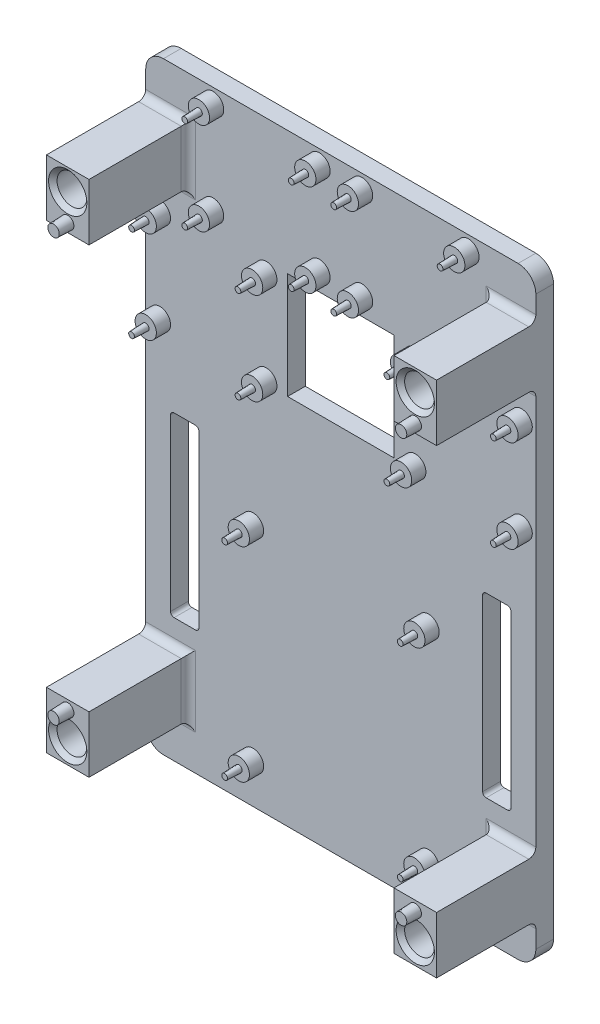
from build123d import *

# Parameters (mm, degrees)
SKIZZE1_W                                  = 110
SKIZZE1_H                                  = 170
AUFSATZ_LINEAR_AUSTRAGEN1_DEPTH            = 5
VERRUNDUNG1_R                              = 5
SKIZZE7_W                                  = 12
SKIZZE7_H                                  = 16
AUFSATZ_LINEAR_AUSTRAGEN3_DEPTH            = 28
VERRUNDUNG2_R                              = 2
SKIZZE8_R                                  = 4.2
SCHNITT_LINEAR_AUSTRAGEN3_DEPTH            = 107.484740691
LINEARES_MUSTER1_COUNT                     = 2
LINEARES_MUSTER1_PITCH                     = 134
LINEARES_MUSTER1_COUNT_DIR2                = 2
LINEARES_MUSTER1_PITCH_DIR2                = 98
SKIZZE9_R                                  = 3
AUFSATZ_LINEAR_AUSTRAGEN4_DEPTH            = 4
SKIZZE10_R                                 = 0.95
AUFSATZ_LINEAR_AUSTRAGEN5_DEPTH            = 4
AUFSATZ_LINEAR_AUSTRAGEN5_DRAFT            = 2
AUFSATZ_LINEAR_AUSTRAGEN5_PROFILE_2_DEPTH  = 4
AUFSATZ_LINEAR_AUSTRAGEN5_PROFILE_2_DRAFT  = 2
AUFSATZ_LINEAR_AUSTRAGEN5_PROFILE_3_DEPTH  = 4
AUFSATZ_LINEAR_AUSTRAGEN5_PROFILE_3_DRAFT  = 2
AUFSATZ_LINEAR_AUSTRAGEN5_PROFILE_4_DEPTH  = 4
AUFSATZ_LINEAR_AUSTRAGEN5_PROFILE_4_DRAFT  = 2
AUFSATZ_LINEAR_AUSTRAGEN5_PROFILE_5_DEPTH  = 4
AUFSATZ_LINEAR_AUSTRAGEN5_PROFILE_5_DRAFT  = 2
AUFSATZ_LINEAR_AUSTRAGEN5_PROFILE_6_DEPTH  = 4
AUFSATZ_LINEAR_AUSTRAGEN5_PROFILE_6_DRAFT  = 2
AUFSATZ_LINEAR_AUSTRAGEN5_PROFILE_7_DEPTH  = 4
AUFSATZ_LINEAR_AUSTRAGEN5_PROFILE_7_DRAFT  = 2
AUFSATZ_LINEAR_AUSTRAGEN5_PROFILE_8_DEPTH  = 4
AUFSATZ_LINEAR_AUSTRAGEN5_PROFILE_8_DRAFT  = 2
AUFSATZ_LINEAR_AUSTRAGEN5_PROFILE_9_DEPTH  = 4
AUFSATZ_LINEAR_AUSTRAGEN5_PROFILE_9_DRAFT  = 2
AUFSATZ_LINEAR_AUSTRAGEN5_PROFILE_10_DEPTH = 4
AUFSATZ_LINEAR_AUSTRAGEN5_PROFILE_10_DRAFT = 2
AUFSATZ_LINEAR_AUSTRAGEN5_PROFILE_11_DEPTH = 4
AUFSATZ_LINEAR_AUSTRAGEN5_PROFILE_11_DRAFT = 2
AUFSATZ_LINEAR_AUSTRAGEN5_PROFILE_12_DEPTH = 4
AUFSATZ_LINEAR_AUSTRAGEN5_PROFILE_12_DRAFT = 2
AUFSATZ_LINEAR_AUSTRAGEN5_PROFILE_13_DEPTH = 4
AUFSATZ_LINEAR_AUSTRAGEN5_PROFILE_13_DRAFT = 2
AUFSATZ_LINEAR_AUSTRAGEN5_PROFILE_14_DEPTH = 4
AUFSATZ_LINEAR_AUSTRAGEN5_PROFILE_14_DRAFT = 2
AUFSATZ_LINEAR_AUSTRAGEN5_PROFILE_15_DEPTH = 4
AUFSATZ_LINEAR_AUSTRAGEN5_PROFILE_15_DRAFT = 2
AUFSATZ_LINEAR_AUSTRAGEN5_PROFILE_16_DEPTH = 4
AUFSATZ_LINEAR_AUSTRAGEN5_PROFILE_16_DRAFT = 2
AUFSATZ_LINEAR_AUSTRAGEN5_PROFILE_17_DEPTH = 4
AUFSATZ_LINEAR_AUSTRAGEN5_PROFILE_17_DRAFT = 2
AUFSATZ_LINEAR_AUSTRAGEN5_PROFILE_18_DEPTH = 4
AUFSATZ_LINEAR_AUSTRAGEN5_PROFILE_18_DRAFT = 2
AUFSATZ_LINEAR_AUSTRAGEN5_PROFILE_19_DEPTH = 4
AUFSATZ_LINEAR_AUSTRAGEN5_PROFILE_19_DRAFT = 2
AUFSATZ_LINEAR_AUSTRAGEN5_PROFILE_20_DEPTH = 4
AUFSATZ_LINEAR_AUSTRAGEN5_PROFILE_20_DRAFT = 2
FASE1_SIZE                                 = 1.2
SKIZZE11_W                                 = 30
SKIZZE11_H                                 = 30
SCHNITT_LINEAR_AUSTRAGEN4_DEPTH            = 106.0428484
SKIZZE12_R                                 = 1.75
AUFSATZ_LINEAR_AUSTRAGEN6_DEPTH            = 4
AUFSATZ_LINEAR_AUSTRAGEN6_DRAFT            = 2
AUFSATZ_LINEAR_AUSTRAGEN6_PROFILE_2_DEPTH  = 4
AUFSATZ_LINEAR_AUSTRAGEN6_PROFILE_2_DRAFT  = 2
AUFSATZ_LINEAR_AUSTRAGEN6_PROFILE_3_DEPTH  = 4
AUFSATZ_LINEAR_AUSTRAGEN6_PROFILE_3_DRAFT  = 2
AUFSATZ_LINEAR_AUSTRAGEN6_PROFILE_4_DEPTH  = 4
AUFSATZ_LINEAR_AUSTRAGEN6_PROFILE_4_DRAFT  = 2
SKIZZE13_R                                 = 2
SCHNITT_LINEAR_AUSTRAGEN5_DEPTH            = 4.5
SKIZZE15_W                                 = 8
SKIZZE15_H                                 = 50
SCHNITT_LINEAR_AUSTRAGEN6_DEPTH            = 107.179093987
VERRUNDUNG3_R                              = 1


with BuildPart() as part:
    # Skizze1 → Aufsatz-Linear austragen1 (new body)
    with BuildSketch(Plane.XY):
        Rectangle(SKIZZE1_W, SKIZZE1_H)
    extrude(amount=AUFSATZ_LINEAR_AUSTRAGEN1_DEPTH)

    # Verrundung1
    verrundung1_edges = [part.edges().sort_by_distance(p)[0] for p in [
        (55, -85, 2.5),
        (-55, -85, 2.5),
        (-55, 85, 2.5),
        (55, 85, 2.5),
    ]]
    fillet(verrundung1_edges, radius=VERRUNDUNG1_R)

    # Skizze7 → Aufsatz-Linear austragen3 (add)
    with BuildSketch(Plane.XY.offset(5)):
        with Locations((-49, 65)):
            Rectangle(SKIZZE7_W, SKIZZE7_H)
        with Locations((49, 65)):
            Rectangle(SKIZZE7_W, SKIZZE7_H)
        with Locations((49, -65)):
            Rectangle(SKIZZE7_W, SKIZZE7_H)
        with Locations((-49, -65)):
            Rectangle(SKIZZE7_W, SKIZZE7_H)
    extrude(amount=AUFSATZ_LINEAR_AUSTRAGEN3_DEPTH)

    # Verrundung2
    verrundung2_edges = [part.edges().sort_by_distance(p)[0] for p in [
        (-49, 57, 5),
        (-43, 65, 5),
        (-49, 73, 5),
        (49, 73, 5),
        (43, 65, 5),
        (49, 57, 5),
        (49, -57, 5),
        (43, -65, 5),
        (49, -73, 5),
        (-49, -73, 5),
        (-43, -65, 5),
        (-49, -57, 5),
    ]]
    fillet(verrundung2_edges, radius=VERRUNDUNG2_R)

    # Skizze8 → Schnitt-Linear austragen3 (cut, through all)
    with BuildSketch(Plane.XY.offset(33)):
        with Locations((-49, 67)):
            Circle(SKIZZE8_R)
    schnitt_linear_austragen3 = extrude(amount=-SCHNITT_LINEAR_AUSTRAGEN3_DEPTH, mode=Mode.SUBTRACT)

    # Lineares Muster1: Schnitt-Linear austragen3 2 × 2
    with Locations(*[(j * LINEARES_MUSTER1_PITCH_DIR2, -i * LINEARES_MUSTER1_PITCH, 0) for i in range(LINEARES_MUSTER1_COUNT) for j in range(LINEARES_MUSTER1_COUNT_DIR2) if (i, j) != (0, 0)]):
        add(schnitt_linear_austragen3, mode=Mode.SUBTRACT)

    # Skizze9 → Aufsatz-Linear austragen4 (add)
    with BuildSketch(Plane.XY.offset(5)):
        with Locations(Location((24.75, -73.75, 0), (0, 0, 180))):
            Circle(SKIZZE9_R)
        with Locations(Location((24.75, -16.25, 0), (0, 0, 180))):
            Circle(SKIZZE9_R)
        with Locations(Location((-24.75, -16.25, 0), (0, 0, 180))):
            Circle(SKIZZE9_R)
        with Locations(Location((-24.75, -73.75, 0), (0, 0, 180))):
            Circle(SKIZZE9_R)
        with Locations(Location((-36, 81, 0), (0, 0, 180))):
            Circle(SKIZZE9_R)
        with Locations(Location((-6, 81, 0), (0, 0, 180))):
            Circle(SKIZZE9_R)
        with Locations(Location((-36, 55, 0), (0, 0, 180))):
            Circle(SKIZZE9_R)
        with Locations(Location((-6, 55, 0), (0, 0, 180))):
            Circle(SKIZZE9_R)
        with Locations(Location((6, 81, 0), (0, 0, 180))):
            Circle(SKIZZE9_R)
        with Locations(Location((36, 81, 0), (0, 0, 180))):
            Circle(SKIZZE9_R)
        with Locations(Location((36, 55, 0), (0, 0, 180))):
            Circle(SKIZZE9_R)
        with Locations(Location((6, 55, 0), (0, 0, 180))):
            Circle(SKIZZE9_R)
        with Locations(Location((21, 47, 0), (0, 0, 180))):
            Circle(SKIZZE9_R)
        with Locations(Location((51, 47, 0), (0, 0, 180))):
            Circle(SKIZZE9_R)
        with Locations(Location((51, 21, 0), (0, 0, 180))):
            Circle(SKIZZE9_R)
        with Locations(Location((21, 21, 0), (0, 0, 180))):
            Circle(SKIZZE9_R)
        with Locations(Location((-21, 47, 0), (0, 0, 180))):
            Circle(SKIZZE9_R)
        with Locations(Location((-51, 47, 0), (0, 0, 180))):
            Circle(SKIZZE9_R)
        with Locations(Location((-51, 21, 0), (0, 0, 180))):
            Circle(SKIZZE9_R)
        with Locations(Location((-21, 21, 0), (0, 0, 180))):
            Circle(SKIZZE9_R)
    extrude(amount=AUFSATZ_LINEAR_AUSTRAGEN4_DEPTH)


with BuildPart() as aufsatz_linear_austragen5_tool:
    # Skizze10 → Aufsatz-Linear austragen5 (with draft: the straight prism first)
    with BuildSketch(Plane.XY.offset(9)):
        with Locations((24.75, -73.75)):
            Circle(SKIZZE10_R)
    extrude(amount=AUFSATZ_LINEAR_AUSTRAGEN5_DEPTH)
    # Aufsatz-Linear austragen5: the draft: its side faces are tilted about the plane it starts from
    aufsatz_linear_austragen5_sides = [aufsatz_linear_austragen5_tool.faces().sort_by_distance(p)[0] for p in [
        (23.8, -73.75, 11),
    ]]
    draft(aufsatz_linear_austragen5_sides, Plane.XY.offset(9), AUFSATZ_LINEAR_AUSTRAGEN5_DRAFT)


with BuildPart() as part_1:
    add(part.part)

    # Aufsatz-Linear austragen5: add aufsatz_linear_austragen5_tool
    add(aufsatz_linear_austragen5_tool.part)


with BuildPart() as aufsatz_linear_austragen5_profile_2_tool:
    # Skizze10 → Aufsatz-Linear austragen5 profile 2 (with draft: the straight prism first)
    with BuildSketch(Plane.XY.offset(9)):
        with Locations((24.75, -16.25)):
            Circle(SKIZZE10_R)
    extrude(amount=AUFSATZ_LINEAR_AUSTRAGEN5_PROFILE_2_DEPTH)
    # Aufsatz-Linear austragen5 profile 2: the draft: its side faces are tilted about the plane it starts from
    aufsatz_linear_austragen5_profile_2_sides = [aufsatz_linear_austragen5_profile_2_tool.faces().sort_by_distance(p)[0] for p in [
        (23.8, -16.25, 11),
    ]]
    draft(aufsatz_linear_austragen5_profile_2_sides, Plane.XY.offset(9), AUFSATZ_LINEAR_AUSTRAGEN5_PROFILE_2_DRAFT)


with BuildPart() as part_2:
    add(part_1.part)

    # Aufsatz-Linear austragen5 profile 2: add aufsatz_linear_austragen5_profile_2_tool
    add(aufsatz_linear_austragen5_profile_2_tool.part)


with BuildPart() as aufsatz_linear_austragen5_profile_3_tool:
    # Skizze10 → Aufsatz-Linear austragen5 profile 3 (with draft: the straight prism first)
    with BuildSketch(Plane.XY.offset(9)):
        with Locations((-24.75, -16.25)):
            Circle(SKIZZE10_R)
    extrude(amount=AUFSATZ_LINEAR_AUSTRAGEN5_PROFILE_3_DEPTH)
    # Aufsatz-Linear austragen5 profile 3: the draft: its side faces are tilted about the plane it starts from
    aufsatz_linear_austragen5_profile_3_sides = [aufsatz_linear_austragen5_profile_3_tool.faces().sort_by_distance(p)[0] for p in [
        (-25.7, -16.25, 11),
    ]]
    draft(aufsatz_linear_austragen5_profile_3_sides, Plane.XY.offset(9), AUFSATZ_LINEAR_AUSTRAGEN5_PROFILE_3_DRAFT)


with BuildPart() as part_3:
    add(part_2.part)

    # Aufsatz-Linear austragen5 profile 3: add aufsatz_linear_austragen5_profile_3_tool
    add(aufsatz_linear_austragen5_profile_3_tool.part)


with BuildPart() as aufsatz_linear_austragen5_profile_4_tool:
    # Skizze10 → Aufsatz-Linear austragen5 profile 4 (with draft: the straight prism first)
    with BuildSketch(Plane.XY.offset(9)):
        with Locations((-24.75, -73.75)):
            Circle(SKIZZE10_R)
    extrude(amount=AUFSATZ_LINEAR_AUSTRAGEN5_PROFILE_4_DEPTH)
    # Aufsatz-Linear austragen5 profile 4: the draft: its side faces are tilted about the plane it starts from
    aufsatz_linear_austragen5_profile_4_sides = [aufsatz_linear_austragen5_profile_4_tool.faces().sort_by_distance(p)[0] for p in [
        (-25.7, -73.75, 11),
    ]]
    draft(aufsatz_linear_austragen5_profile_4_sides, Plane.XY.offset(9), AUFSATZ_LINEAR_AUSTRAGEN5_PROFILE_4_DRAFT)


with BuildPart() as part_4:
    add(part_3.part)

    # Aufsatz-Linear austragen5 profile 4: add aufsatz_linear_austragen5_profile_4_tool
    add(aufsatz_linear_austragen5_profile_4_tool.part)


with BuildPart() as aufsatz_linear_austragen5_profile_5_tool:
    # Skizze10 → Aufsatz-Linear austragen5 profile 5 (with draft: the straight prism first)
    with BuildSketch(Plane.XY.offset(9)):
        with Locations((-51, 47)):
            Circle(SKIZZE10_R)
    extrude(amount=AUFSATZ_LINEAR_AUSTRAGEN5_PROFILE_5_DEPTH)
    # Aufsatz-Linear austragen5 profile 5: the draft: its side faces are tilted about the plane it starts from
    aufsatz_linear_austragen5_profile_5_sides = [aufsatz_linear_austragen5_profile_5_tool.faces().sort_by_distance(p)[0] for p in [
        (-51.95, 47, 11),
    ]]
    draft(aufsatz_linear_austragen5_profile_5_sides, Plane.XY.offset(9), AUFSATZ_LINEAR_AUSTRAGEN5_PROFILE_5_DRAFT)


with BuildPart() as part_5:
    add(part_4.part)

    # Aufsatz-Linear austragen5 profile 5: add aufsatz_linear_austragen5_profile_5_tool
    add(aufsatz_linear_austragen5_profile_5_tool.part)


with BuildPart() as aufsatz_linear_austragen5_profile_6_tool:
    # Skizze10 → Aufsatz-Linear austragen5 profile 6 (with draft: the straight prism first)
    with BuildSketch(Plane.XY.offset(9)):
        with Locations((-51, 21)):
            Circle(SKIZZE10_R)
    extrude(amount=AUFSATZ_LINEAR_AUSTRAGEN5_PROFILE_6_DEPTH)
    # Aufsatz-Linear austragen5 profile 6: the draft: its side faces are tilted about the plane it starts from
    aufsatz_linear_austragen5_profile_6_sides = [aufsatz_linear_austragen5_profile_6_tool.faces().sort_by_distance(p)[0] for p in [
        (-51.95, 21, 11),
    ]]
    draft(aufsatz_linear_austragen5_profile_6_sides, Plane.XY.offset(9), AUFSATZ_LINEAR_AUSTRAGEN5_PROFILE_6_DRAFT)


with BuildPart() as part_6:
    add(part_5.part)

    # Aufsatz-Linear austragen5 profile 6: add aufsatz_linear_austragen5_profile_6_tool
    add(aufsatz_linear_austragen5_profile_6_tool.part)


with BuildPart() as aufsatz_linear_austragen5_profile_7_tool:
    # Skizze10 → Aufsatz-Linear austragen5 profile 7 (with draft: the straight prism first)
    with BuildSketch(Plane.XY.offset(9)):
        with Locations((-21, 21)):
            Circle(SKIZZE10_R)
    extrude(amount=AUFSATZ_LINEAR_AUSTRAGEN5_PROFILE_7_DEPTH)
    # Aufsatz-Linear austragen5 profile 7: the draft: its side faces are tilted about the plane it starts from
    aufsatz_linear_austragen5_profile_7_sides = [aufsatz_linear_austragen5_profile_7_tool.faces().sort_by_distance(p)[0] for p in [
        (-21.95, 21, 11),
    ]]
    draft(aufsatz_linear_austragen5_profile_7_sides, Plane.XY.offset(9), AUFSATZ_LINEAR_AUSTRAGEN5_PROFILE_7_DRAFT)


with BuildPart() as part_7:
    add(part_6.part)

    # Aufsatz-Linear austragen5 profile 7: add aufsatz_linear_austragen5_profile_7_tool
    add(aufsatz_linear_austragen5_profile_7_tool.part)


with BuildPart() as aufsatz_linear_austragen5_profile_8_tool:
    # Skizze10 → Aufsatz-Linear austragen5 profile 8 (with draft: the straight prism first)
    with BuildSketch(Plane.XY.offset(9)):
        with Locations((-21, 47)):
            Circle(SKIZZE10_R)
    extrude(amount=AUFSATZ_LINEAR_AUSTRAGEN5_PROFILE_8_DEPTH)
    # Aufsatz-Linear austragen5 profile 8: the draft: its side faces are tilted about the plane it starts from
    aufsatz_linear_austragen5_profile_8_sides = [aufsatz_linear_austragen5_profile_8_tool.faces().sort_by_distance(p)[0] for p in [
        (-21.95, 47, 11),
    ]]
    draft(aufsatz_linear_austragen5_profile_8_sides, Plane.XY.offset(9), AUFSATZ_LINEAR_AUSTRAGEN5_PROFILE_8_DRAFT)


with BuildPart() as part_8:
    add(part_7.part)

    # Aufsatz-Linear austragen5 profile 8: add aufsatz_linear_austragen5_profile_8_tool
    add(aufsatz_linear_austragen5_profile_8_tool.part)


with BuildPart() as aufsatz_linear_austragen5_profile_9_tool:
    # Skizze10 → Aufsatz-Linear austragen5 profile 9 (with draft: the straight prism first)
    with BuildSketch(Plane.XY.offset(9)):
        with Locations((-36, 55)):
            Circle(SKIZZE10_R)
    extrude(amount=AUFSATZ_LINEAR_AUSTRAGEN5_PROFILE_9_DEPTH)
    # Aufsatz-Linear austragen5 profile 9: the draft: its side faces are tilted about the plane it starts from
    aufsatz_linear_austragen5_profile_9_sides = [aufsatz_linear_austragen5_profile_9_tool.faces().sort_by_distance(p)[0] for p in [
        (-36.95, 55, 11),
    ]]
    draft(aufsatz_linear_austragen5_profile_9_sides, Plane.XY.offset(9), AUFSATZ_LINEAR_AUSTRAGEN5_PROFILE_9_DRAFT)


with BuildPart() as part_9:
    add(part_8.part)

    # Aufsatz-Linear austragen5 profile 9: add aufsatz_linear_austragen5_profile_9_tool
    add(aufsatz_linear_austragen5_profile_9_tool.part)


with BuildPart() as aufsatz_linear_austragen5_profile_10_tool:
    # Skizze10 → Aufsatz-Linear austragen5 profile 10 (with draft: the straight prism first)
    with BuildSketch(Plane.XY.offset(9)):
        with Locations((-6, 55)):
            Circle(SKIZZE10_R)
    extrude(amount=AUFSATZ_LINEAR_AUSTRAGEN5_PROFILE_10_DEPTH)
    # Aufsatz-Linear austragen5 profile 10: the draft: its side faces are tilted about the plane it starts from
    aufsatz_linear_austragen5_profile_10_sides = [aufsatz_linear_austragen5_profile_10_tool.faces().sort_by_distance(p)[0] for p in [
        (-6.95, 55, 11),
    ]]
    draft(aufsatz_linear_austragen5_profile_10_sides, Plane.XY.offset(9), AUFSATZ_LINEAR_AUSTRAGEN5_PROFILE_10_DRAFT)


with BuildPart() as part_10:
    add(part_9.part)

    # Aufsatz-Linear austragen5 profile 10: add aufsatz_linear_austragen5_profile_10_tool
    add(aufsatz_linear_austragen5_profile_10_tool.part)


with BuildPart() as aufsatz_linear_austragen5_profile_11_tool:
    # Skizze10 → Aufsatz-Linear austragen5 profile 11 (with draft: the straight prism first)
    with BuildSketch(Plane.XY.offset(9)):
        with Locations((6, 55)):
            Circle(SKIZZE10_R)
    extrude(amount=AUFSATZ_LINEAR_AUSTRAGEN5_PROFILE_11_DEPTH)
    # Aufsatz-Linear austragen5 profile 11: the draft: its side faces are tilted about the plane it starts from
    aufsatz_linear_austragen5_profile_11_sides = [aufsatz_linear_austragen5_profile_11_tool.faces().sort_by_distance(p)[0] for p in [
        (5.05, 55, 11),
    ]]
    draft(aufsatz_linear_austragen5_profile_11_sides, Plane.XY.offset(9), AUFSATZ_LINEAR_AUSTRAGEN5_PROFILE_11_DRAFT)


with BuildPart() as part_11:
    add(part_10.part)

    # Aufsatz-Linear austragen5 profile 11: add aufsatz_linear_austragen5_profile_11_tool
    add(aufsatz_linear_austragen5_profile_11_tool.part)


with BuildPart() as aufsatz_linear_austragen5_profile_12_tool:
    # Skizze10 → Aufsatz-Linear austragen5 profile 12 (with draft: the straight prism first)
    with BuildSketch(Plane.XY.offset(9)):
        with Locations((-36, 81)):
            Circle(SKIZZE10_R)
    extrude(amount=AUFSATZ_LINEAR_AUSTRAGEN5_PROFILE_12_DEPTH)
    # Aufsatz-Linear austragen5 profile 12: the draft: its side faces are tilted about the plane it starts from
    aufsatz_linear_austragen5_profile_12_sides = [aufsatz_linear_austragen5_profile_12_tool.faces().sort_by_distance(p)[0] for p in [
        (-36.95, 81, 11),
    ]]
    draft(aufsatz_linear_austragen5_profile_12_sides, Plane.XY.offset(9), AUFSATZ_LINEAR_AUSTRAGEN5_PROFILE_12_DRAFT)


with BuildPart() as part_12:
    add(part_11.part)

    # Aufsatz-Linear austragen5 profile 12: add aufsatz_linear_austragen5_profile_12_tool
    add(aufsatz_linear_austragen5_profile_12_tool.part)


with BuildPart() as aufsatz_linear_austragen5_profile_13_tool:
    # Skizze10 → Aufsatz-Linear austragen5 profile 13 (with draft: the straight prism first)
    with BuildSketch(Plane.XY.offset(9)):
        with Locations((-6, 81)):
            Circle(SKIZZE10_R)
    extrude(amount=AUFSATZ_LINEAR_AUSTRAGEN5_PROFILE_13_DEPTH)
    # Aufsatz-Linear austragen5 profile 13: the draft: its side faces are tilted about the plane it starts from
    aufsatz_linear_austragen5_profile_13_sides = [aufsatz_linear_austragen5_profile_13_tool.faces().sort_by_distance(p)[0] for p in [
        (-6.95, 81, 11),
    ]]
    draft(aufsatz_linear_austragen5_profile_13_sides, Plane.XY.offset(9), AUFSATZ_LINEAR_AUSTRAGEN5_PROFILE_13_DRAFT)


with BuildPart() as part_13:
    add(part_12.part)

    # Aufsatz-Linear austragen5 profile 13: add aufsatz_linear_austragen5_profile_13_tool
    add(aufsatz_linear_austragen5_profile_13_tool.part)


with BuildPart() as aufsatz_linear_austragen5_profile_14_tool:
    # Skizze10 → Aufsatz-Linear austragen5 profile 14 (with draft: the straight prism first)
    with BuildSketch(Plane.XY.offset(9)):
        with Locations((6, 81)):
            Circle(SKIZZE10_R)
    extrude(amount=AUFSATZ_LINEAR_AUSTRAGEN5_PROFILE_14_DEPTH)
    # Aufsatz-Linear austragen5 profile 14: the draft: its side faces are tilted about the plane it starts from
    aufsatz_linear_austragen5_profile_14_sides = [aufsatz_linear_austragen5_profile_14_tool.faces().sort_by_distance(p)[0] for p in [
        (5.05, 81, 11),
    ]]
    draft(aufsatz_linear_austragen5_profile_14_sides, Plane.XY.offset(9), AUFSATZ_LINEAR_AUSTRAGEN5_PROFILE_14_DRAFT)


with BuildPart() as part_14:
    add(part_13.part)

    # Aufsatz-Linear austragen5 profile 14: add aufsatz_linear_austragen5_profile_14_tool
    add(aufsatz_linear_austragen5_profile_14_tool.part)


with BuildPart() as aufsatz_linear_austragen5_profile_15_tool:
    # Skizze10 → Aufsatz-Linear austragen5 profile 15 (with draft: the straight prism first)
    with BuildSketch(Plane.XY.offset(9)):
        with Locations((36, 81)):
            Circle(SKIZZE10_R)
    extrude(amount=AUFSATZ_LINEAR_AUSTRAGEN5_PROFILE_15_DEPTH)
    # Aufsatz-Linear austragen5 profile 15: the draft: its side faces are tilted about the plane it starts from
    aufsatz_linear_austragen5_profile_15_sides = [aufsatz_linear_austragen5_profile_15_tool.faces().sort_by_distance(p)[0] for p in [
        (35.05, 81, 11),
    ]]
    draft(aufsatz_linear_austragen5_profile_15_sides, Plane.XY.offset(9), AUFSATZ_LINEAR_AUSTRAGEN5_PROFILE_15_DRAFT)


with BuildPart() as part_15:
    add(part_14.part)

    # Aufsatz-Linear austragen5 profile 15: add aufsatz_linear_austragen5_profile_15_tool
    add(aufsatz_linear_austragen5_profile_15_tool.part)


with BuildPart() as aufsatz_linear_austragen5_profile_16_tool:
    # Skizze10 → Aufsatz-Linear austragen5 profile 16 (with draft: the straight prism first)
    with BuildSketch(Plane.XY.offset(9)):
        with Locations((36, 55)):
            Circle(SKIZZE10_R)
    extrude(amount=AUFSATZ_LINEAR_AUSTRAGEN5_PROFILE_16_DEPTH)
    # Aufsatz-Linear austragen5 profile 16: the draft: its side faces are tilted about the plane it starts from
    aufsatz_linear_austragen5_profile_16_sides = [aufsatz_linear_austragen5_profile_16_tool.faces().sort_by_distance(p)[0] for p in [
        (35.05, 55, 11),
    ]]
    draft(aufsatz_linear_austragen5_profile_16_sides, Plane.XY.offset(9), AUFSATZ_LINEAR_AUSTRAGEN5_PROFILE_16_DRAFT)


with BuildPart() as part_16:
    add(part_15.part)

    # Aufsatz-Linear austragen5 profile 16: add aufsatz_linear_austragen5_profile_16_tool
    add(aufsatz_linear_austragen5_profile_16_tool.part)


with BuildPart() as aufsatz_linear_austragen5_profile_17_tool:
    # Skizze10 → Aufsatz-Linear austragen5 profile 17 (with draft: the straight prism first)
    with BuildSketch(Plane.XY.offset(9)):
        with Locations((21, 47)):
            Circle(SKIZZE10_R)
    extrude(amount=AUFSATZ_LINEAR_AUSTRAGEN5_PROFILE_17_DEPTH)
    # Aufsatz-Linear austragen5 profile 17: the draft: its side faces are tilted about the plane it starts from
    aufsatz_linear_austragen5_profile_17_sides = [aufsatz_linear_austragen5_profile_17_tool.faces().sort_by_distance(p)[0] for p in [
        (20.05, 47, 11),
    ]]
    draft(aufsatz_linear_austragen5_profile_17_sides, Plane.XY.offset(9), AUFSATZ_LINEAR_AUSTRAGEN5_PROFILE_17_DRAFT)


with BuildPart() as part_17:
    add(part_16.part)

    # Aufsatz-Linear austragen5 profile 17: add aufsatz_linear_austragen5_profile_17_tool
    add(aufsatz_linear_austragen5_profile_17_tool.part)


with BuildPart() as aufsatz_linear_austragen5_profile_18_tool:
    # Skizze10 → Aufsatz-Linear austragen5 profile 18 (with draft: the straight prism first)
    with BuildSketch(Plane.XY.offset(9)):
        with Locations((51, 47)):
            Circle(SKIZZE10_R)
    extrude(amount=AUFSATZ_LINEAR_AUSTRAGEN5_PROFILE_18_DEPTH)
    # Aufsatz-Linear austragen5 profile 18: the draft: its side faces are tilted about the plane it starts from
    aufsatz_linear_austragen5_profile_18_sides = [aufsatz_linear_austragen5_profile_18_tool.faces().sort_by_distance(p)[0] for p in [
        (50.05, 47, 11),
    ]]
    draft(aufsatz_linear_austragen5_profile_18_sides, Plane.XY.offset(9), AUFSATZ_LINEAR_AUSTRAGEN5_PROFILE_18_DRAFT)


with BuildPart() as part_18:
    add(part_17.part)

    # Aufsatz-Linear austragen5 profile 18: add aufsatz_linear_austragen5_profile_18_tool
    add(aufsatz_linear_austragen5_profile_18_tool.part)


with BuildPart() as aufsatz_linear_austragen5_profile_19_tool:
    # Skizze10 → Aufsatz-Linear austragen5 profile 19 (with draft: the straight prism first)
    with BuildSketch(Plane.XY.offset(9)):
        with Locations((21, 21)):
            Circle(SKIZZE10_R)
    extrude(amount=AUFSATZ_LINEAR_AUSTRAGEN5_PROFILE_19_DEPTH)
    # Aufsatz-Linear austragen5 profile 19: the draft: its side faces are tilted about the plane it starts from
    aufsatz_linear_austragen5_profile_19_sides = [aufsatz_linear_austragen5_profile_19_tool.faces().sort_by_distance(p)[0] for p in [
        (20.05, 21, 11),
    ]]
    draft(aufsatz_linear_austragen5_profile_19_sides, Plane.XY.offset(9), AUFSATZ_LINEAR_AUSTRAGEN5_PROFILE_19_DRAFT)


with BuildPart() as part_19:
    add(part_18.part)

    # Aufsatz-Linear austragen5 profile 19: add aufsatz_linear_austragen5_profile_19_tool
    add(aufsatz_linear_austragen5_profile_19_tool.part)


with BuildPart() as aufsatz_linear_austragen5_profile_20_tool:
    # Skizze10 → Aufsatz-Linear austragen5 profile 20 (with draft: the straight prism first)
    with BuildSketch(Plane.XY.offset(9)):
        with Locations((51, 21)):
            Circle(SKIZZE10_R)
    extrude(amount=AUFSATZ_LINEAR_AUSTRAGEN5_PROFILE_20_DEPTH)
    # Aufsatz-Linear austragen5 profile 20: the draft: its side faces are tilted about the plane it starts from
    aufsatz_linear_austragen5_profile_20_sides = [aufsatz_linear_austragen5_profile_20_tool.faces().sort_by_distance(p)[0] for p in [
        (50.05, 21, 11),
    ]]
    draft(aufsatz_linear_austragen5_profile_20_sides, Plane.XY.offset(9), AUFSATZ_LINEAR_AUSTRAGEN5_PROFILE_20_DRAFT)


with BuildPart() as part_20:
    add(part_19.part)

    # Aufsatz-Linear austragen5 profile 20: add aufsatz_linear_austragen5_profile_20_tool
    add(aufsatz_linear_austragen5_profile_20_tool.part)

    # Fase1
    fase1_edges = [part_20.edges().sort_by_distance(p)[0] for p in [
        (-53.2, 67, 33),
        (44.8, 67, 33),
        (-53.2, -67, 33),
        (44.8, -67, 33),
    ]]
    chamfer(fase1_edges, length=FASE1_SIZE)

    # Skizze11 → Schnitt-Linear austragen4 (cut, through all)
    with BuildSketch(Plane.XY.offset(5)):
        with Locations((0, 35)):
            Rectangle(SKIZZE11_W, SKIZZE11_H)
    extrude(amount=-SCHNITT_LINEAR_AUSTRAGEN4_DEPTH, mode=Mode.SUBTRACT)


with BuildPart() as aufsatz_linear_austragen6_tool:
    # Skizze12 → Aufsatz-Linear austragen6 (with draft: the straight prism first)
    with BuildSketch(Plane.XY.offset(33)):
        with Locations((-49, 59.5)):
            Circle(SKIZZE12_R)
    extrude(amount=AUFSATZ_LINEAR_AUSTRAGEN6_DEPTH)
    # Aufsatz-Linear austragen6: the draft: its side faces are tilted about the plane it starts from
    aufsatz_linear_austragen6_sides = [aufsatz_linear_austragen6_tool.faces().sort_by_distance(p)[0] for p in [
        (-50.75, 59.5, 35),
    ]]
    draft(aufsatz_linear_austragen6_sides, Plane.XY.offset(33), AUFSATZ_LINEAR_AUSTRAGEN6_DRAFT)


with BuildPart() as part_21:
    add(part_20.part)

    # Aufsatz-Linear austragen6: add aufsatz_linear_austragen6_tool
    add(aufsatz_linear_austragen6_tool.part)


with BuildPart() as aufsatz_linear_austragen6_profile_2_tool:
    # Skizze12 → Aufsatz-Linear austragen6 profile 2 (with draft: the straight prism first)
    with BuildSketch(Plane.XY.offset(33)):
        with Locations((49, 59.5)):
            Circle(SKIZZE12_R)
    extrude(amount=AUFSATZ_LINEAR_AUSTRAGEN6_PROFILE_2_DEPTH)
    # Aufsatz-Linear austragen6 profile 2: the draft: its side faces are tilted about the plane it starts from
    aufsatz_linear_austragen6_profile_2_sides = [aufsatz_linear_austragen6_profile_2_tool.faces().sort_by_distance(p)[0] for p in [
        (47.25, 59.5, 35),
    ]]
    draft(aufsatz_linear_austragen6_profile_2_sides, Plane.XY.offset(33), AUFSATZ_LINEAR_AUSTRAGEN6_PROFILE_2_DRAFT)


with BuildPart() as part_22:
    add(part_21.part)

    # Aufsatz-Linear austragen6 profile 2: add aufsatz_linear_austragen6_profile_2_tool
    add(aufsatz_linear_austragen6_profile_2_tool.part)


with BuildPart() as aufsatz_linear_austragen6_profile_3_tool:
    # Skizze12 → Aufsatz-Linear austragen6 profile 3 (with draft: the straight prism first)
    with BuildSketch(Plane.XY.offset(33)):
        with Locations((-49, -59.5)):
            Circle(SKIZZE12_R)
    extrude(amount=AUFSATZ_LINEAR_AUSTRAGEN6_PROFILE_3_DEPTH)
    # Aufsatz-Linear austragen6 profile 3: the draft: its side faces are tilted about the plane it starts from
    aufsatz_linear_austragen6_profile_3_sides = [aufsatz_linear_austragen6_profile_3_tool.faces().sort_by_distance(p)[0] for p in [
        (-50.75, -59.5, 35),
    ]]
    draft(aufsatz_linear_austragen6_profile_3_sides, Plane.XY.offset(33), AUFSATZ_LINEAR_AUSTRAGEN6_PROFILE_3_DRAFT)


with BuildPart() as part_23:
    add(part_22.part)

    # Aufsatz-Linear austragen6 profile 3: add aufsatz_linear_austragen6_profile_3_tool
    add(aufsatz_linear_austragen6_profile_3_tool.part)


with BuildPart() as aufsatz_linear_austragen6_profile_4_tool:
    # Skizze12 → Aufsatz-Linear austragen6 profile 4 (with draft: the straight prism first)
    with BuildSketch(Plane.XY.offset(33)):
        with Locations((49, -59.5)):
            Circle(SKIZZE12_R)
    extrude(amount=AUFSATZ_LINEAR_AUSTRAGEN6_PROFILE_4_DEPTH)
    # Aufsatz-Linear austragen6 profile 4: the draft: its side faces are tilted about the plane it starts from
    aufsatz_linear_austragen6_profile_4_sides = [aufsatz_linear_austragen6_profile_4_tool.faces().sort_by_distance(p)[0] for p in [
        (47.25, -59.5, 35),
    ]]
    draft(aufsatz_linear_austragen6_profile_4_sides, Plane.XY.offset(33), AUFSATZ_LINEAR_AUSTRAGEN6_PROFILE_4_DRAFT)


with BuildPart() as part_24:
    add(part_23.part)

    # Aufsatz-Linear austragen6 profile 4: add aufsatz_linear_austragen6_profile_4_tool
    add(aufsatz_linear_austragen6_profile_4_tool.part)

    # Skizze13 → Schnitt-Linear austragen5 (cut)
    with BuildSketch(Plane(origin=(0, 0, 0), x_dir=(-1, 0, 0), z_dir=(0, 0, -1))):
        with Locations((49, 59.5)):
            Circle(SKIZZE13_R)
        with Locations(Location((-49, 59.5, 0), (0, 0, 180))):
            Circle(SKIZZE13_R)
        with Locations((-49, -59.5)):
            Circle(SKIZZE13_R)
        with Locations(Location((49, -59.5, 0), (0, 0, 180))):
            Circle(SKIZZE13_R)
    extrude(amount=-SCHNITT_LINEAR_AUSTRAGEN5_DEPTH, mode=Mode.SUBTRACT)

    # Skizze15 → Schnitt-Linear austragen6 (cut, through all)
    with BuildSketch(Plane.XY.offset(5)):
        with Locations((44, -25)):
            Rectangle(SKIZZE15_W, SKIZZE15_H)
        with Locations((-44, -25)):
            Rectangle(SKIZZE15_W, SKIZZE15_H)
    extrude(amount=-SCHNITT_LINEAR_AUSTRAGEN6_DEPTH, mode=Mode.SUBTRACT)

    # Verrundung3
    verrundung3_edges = [part_24.edges().sort_by_distance(p)[0] for p in [
        (48, 0, 2.5),
        (48, -50, 2.5),
        (40, -50, 2.5),
        (40, 0, 2.5),
        (-48, -50, 2.5),
        (-48, 0, 2.5),
        (-40, 0, 2.5),
        (-40, -50, 2.5),
    ]]
    fillet(verrundung3_edges, radius=VERRUNDUNG3_R)


solid = part_24.part
